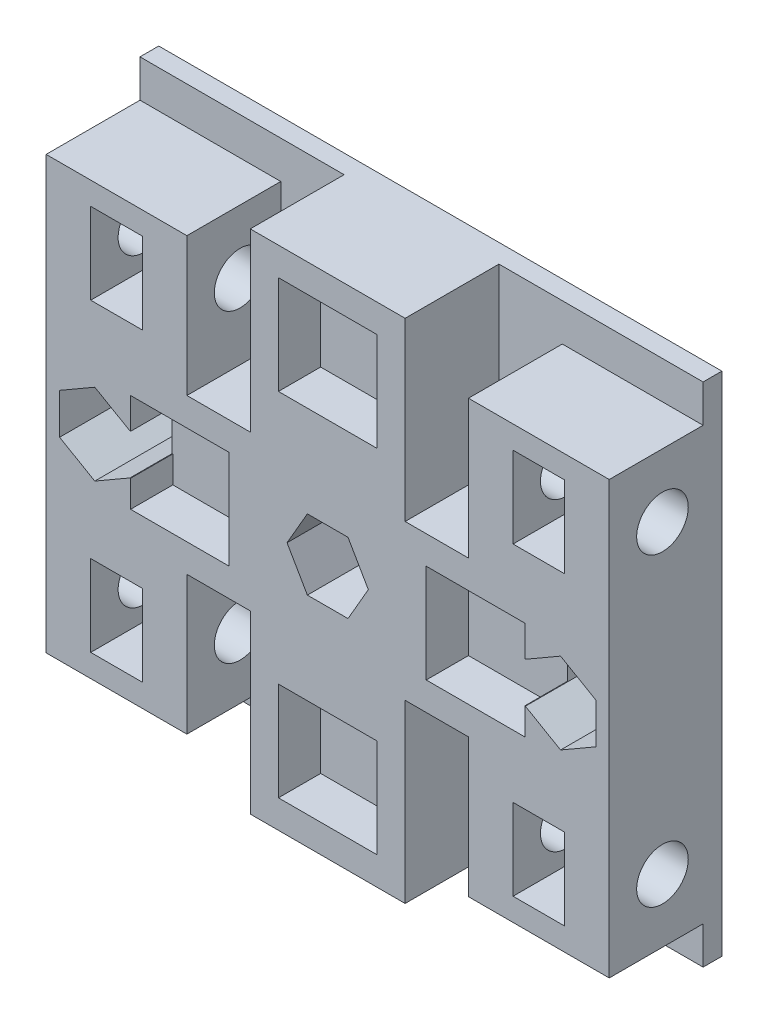
from build123d import *

# Parameters (mm, degrees)
ESQUISSE1_W               = 60
ESQUISSE1_H               = 54
ESQUISSE1_R               = 2
BOSS_EXTRU_1_DEPTH        = 2
ESQUISSE2_W               = 15
ESQUISSE2_H               = 13.5
BOSS_EXTRU_2_DEPTH        = 10
ENL_V_MAT_EXTRU_2_DEPTH   = 16
ESQUISSE5_W               = 4.75
ESQUISSE5_H               = 13.5
BOSS_EXTRU_3_DEPTH        = 12
ESQUISSE6_W               = 5.5
ESQUISSE6_H               = 8.66
ENL_V_MAT_EXTRU_3_DEPTH   = 6.25
ESQUISSE7_R               = 2.75
ENL_V_MAT_EXTRU_4_DEPTH   = 28
SYM_TRIE2_COPY_1_SKETCH_W = 15
SYM_TRIE2_COPY_1_SKETCH_H = 13.5
SYM_TRIE2_COPY_1_DEPTH    = 10
SYM_TRIE2_COPY_2_DEPTH    = 16
SYM_TRIE2_COPY_3_SKETCH_W = 4.75
SYM_TRIE2_COPY_3_SKETCH_H = 13.5
SYM_TRIE2_COPY_3_DEPTH    = 12
SYM_TRIE2_COPY_4_SKETCH_W = 5.5
SYM_TRIE2_COPY_4_SKETCH_H = 8.66
SYM_TRIE2_COPY_4_DEPTH    = 6.25
SYM_TRIE2_COPY_5_SKETCH_R = 2.75
SYM_TRIE2_COPY_5_DEPTH    = 28
ESQUISSE8_W               = 10.5
ESQUISSE8_H               = 3
BOSS_EXTRU_4_DEPTH        = 10
ESQUISSE12_W              = 15
ESQUISSE12_H              = 19
BOSS_EXTRU_6_DEPTH        = 10
ESQUISSE9_W               = 16.5
ESQUISSE9_H               = 16.5
ESQUISSE9_W_2             = 10.5
ESQUISSE9_H_2             = 10.5
BOSS_EXTRU_7_DEPTH        = 10
ENL_V_MAT_EXTRU_6_DEPTH   = 21
ESQUISSE13_W              = 10.5
ESQUISSE13_H              = 10.5
ENL_V_MAT_EXTRU_7_DEPTH   = 21
ESQUISSE15_R              = 2
ESQUISSE15_W              = 0.75
ESQUISSE15_H              = 2.25
BOSS_EXTRU_9_DEPTH        = 10
ENL_V_MAT_EXTRU_8_DEPTH   = 10
ESQUISSE17_W              = 10.5
ESQUISSE17_H              = 10.5
BOSS_EXTRU_10_DEPTH       = 5.5
ESQUISSE18_W              = 4.5
ESQUISSE18_H              = 4.330127019
ENL_V_MAT_EXTRU_9_DEPTH   = 1.5


with BuildPart() as part:
    # Esquisse1 → Boss.-Extru.1 (new body)
    with BuildSketch(Plane.XY):
        with Locations((30, -27)):
            Rectangle(ESQUISSE1_W, ESQUISSE1_H)
        with Locations((5, -27)):
            Circle(ESQUISSE1_R, mode=Mode.SUBTRACT)
        with Locations((30, -27)):
            Circle(ESQUISSE1_R, mode=Mode.SUBTRACT)
        with Locations((55, -27)):
            Circle(ESQUISSE1_R, mode=Mode.SUBTRACT)
    extrude(amount=BOSS_EXTRU_1_DEPTH)

    # Esquisse2 → Boss.-Extru.2 (add)
    with BuildSketch(Plane.XY.offset(2)):
        with Locations((7.5, -43.25)):
            Rectangle(ESQUISSE2_W, ESQUISSE2_H)
    boss_extru_2 = extrude(amount=BOSS_EXTRU_2_DEPTH)

    # Esquisse4 → Enlèv. mat.-Extru.2 (cut)
    with BuildSketch(Plane.ZY):
        Polygon((9.5, -45.415063509), (9.5, -41.084936491), (5.75, -38.919872981), (2, -41.084936491), (2, -45.415063509), (5.75, -47.580127019), align=None)
    enl_v_mat_extru_2 = extrude(amount=-ENL_V_MAT_EXTRU_2_DEPTH, mode=Mode.SUBTRACT)

    # Esquisse5 → Boss.-Extru.3 (add)
    with BuildSketch(Plane.XY.offset(12)):
        with Locations((2.375, -43.25)):
            Rectangle(ESQUISSE5_W, ESQUISSE5_H)
        with Locations((12.625, -43.25)):
            Rectangle(ESQUISSE5_W, ESQUISSE5_H)
    boss_extru_3 = extrude(amount=-BOSS_EXTRU_3_DEPTH)

    # Esquisse6 → Enlèv. mat.-Extru.3 (cut)
    with BuildSketch(Plane.XY.offset(12)):
        with Locations((7.5, -43.25)):
            Rectangle(ESQUISSE6_W, ESQUISSE6_H)
    enl_v_mat_extru_3 = extrude(amount=-ENL_V_MAT_EXTRU_3_DEPTH, mode=Mode.SUBTRACT)

    # Esquisse7 → Enlèv. mat.-Extru.4 (cut)
    with BuildSketch(Plane.ZY):
        with Locations((6.33, -43.25)):
            Circle(ESQUISSE7_R)
    enl_v_mat_extru_4 = extrude(amount=-ENL_V_MAT_EXTRU_4_DEPTH, mode=Mode.SUBTRACT)

    # Symétrie1: Boss.-Extru.2, Enlèv. mat.-Extru.2, Boss.-Extru.3, Enlèv. mat.-Extru.3, Enlèv. mat.-Extru.4 across plane
    add(boss_extru_2.mirror(Plane(origin=(0, -27, 0), x_dir=(0, 0, 1), z_dir=(0, -1, 0))))
    add(enl_v_mat_extru_2.mirror(Plane(origin=(0, -27, 0), x_dir=(0, 0, 1), z_dir=(0, -1, 0))), mode=Mode.SUBTRACT)
    add(boss_extru_3.mirror(Plane(origin=(0, -27, 0), x_dir=(0, 0, 1), z_dir=(0, -1, 0))))
    add(enl_v_mat_extru_3.mirror(Plane(origin=(0, -27, 0), x_dir=(0, 0, 1), z_dir=(0, -1, 0))), mode=Mode.SUBTRACT)
    add(enl_v_mat_extru_4.mirror(Plane(origin=(0, -27, 0), x_dir=(0, 0, 1), z_dir=(0, -1, 0))), mode=Mode.SUBTRACT)

    # Symétrie2: Boss.-Extru.2, Enlèv. mat.-Extru.2, Boss.-Extru.3, Enlèv. mat.-Extru.3, Enlèv. mat.-Extru.4 across plane
    add(boss_extru_2.mirror(Plane.ZY.offset(-30)))
    add(enl_v_mat_extru_2.mirror(Plane.ZY.offset(-30)), mode=Mode.SUBTRACT)
    add(boss_extru_3.mirror(Plane.ZY.offset(-30)))
    add(enl_v_mat_extru_3.mirror(Plane.ZY.offset(-30)), mode=Mode.SUBTRACT)
    add(enl_v_mat_extru_4.mirror(Plane.ZY.offset(-30)), mode=Mode.SUBTRACT)

    # Symétrie2 copy 1 sketch → Symétrie2 copy 1 (add)
    with BuildSketch(Plane(origin=(60, -54, 2), x_dir=(-1, 0, 0), z_dir=(0, 0, 1))):
        with Locations((7.5, -43.25)):
            Rectangle(SYM_TRIE2_COPY_1_SKETCH_W, SYM_TRIE2_COPY_1_SKETCH_H)
    extrude(amount=SYM_TRIE2_COPY_1_DEPTH)

    # Symétrie2 copy 2 sketch → Symétrie2 copy 2 (cut)
    with BuildSketch(Plane(origin=(60, -54, 0), x_dir=(0, 0, 1), z_dir=(1, 0, 0))):
        Polygon((9.5, -45.415063509), (9.5, -41.084936491), (5.75, -38.919872981), (2, -41.084936491), (2, -45.415063509), (5.75, -47.580127019), align=None)
    extrude(amount=-SYM_TRIE2_COPY_2_DEPTH, mode=Mode.SUBTRACT)

    # Symétrie2 copy 3 sketch → Symétrie2 copy 3 (add)
    with BuildSketch(Plane(origin=(60, -54, 12), x_dir=(-1, 0, 0), z_dir=(0, 0, 1))):
        with Locations((2.375, -43.25)):
            Rectangle(SYM_TRIE2_COPY_3_SKETCH_W, SYM_TRIE2_COPY_3_SKETCH_H)
        with Locations((12.625, -43.25)):
            Rectangle(SYM_TRIE2_COPY_3_SKETCH_W, SYM_TRIE2_COPY_3_SKETCH_H)
    extrude(amount=-SYM_TRIE2_COPY_3_DEPTH)

    # Symétrie2 copy 4 sketch → Symétrie2 copy 4 (cut)
    with BuildSketch(Plane(origin=(60, -54, 12), x_dir=(-1, 0, 0), z_dir=(0, 0, 1))):
        with Locations((7.5, -43.25)):
            Rectangle(SYM_TRIE2_COPY_4_SKETCH_W, SYM_TRIE2_COPY_4_SKETCH_H)
    extrude(amount=-SYM_TRIE2_COPY_4_DEPTH, mode=Mode.SUBTRACT)

    # Symétrie2 copy 5 sketch → Symétrie2 copy 5 (cut)
    with BuildSketch(Plane(origin=(60, -54, 0), x_dir=(0, 0, 1), z_dir=(1, 0, 0))):
        with Locations((6.33, -43.25)):
            Circle(SYM_TRIE2_COPY_5_SKETCH_R)
    extrude(amount=-SYM_TRIE2_COPY_5_DEPTH, mode=Mode.SUBTRACT)

    # Esquisse8 → Boss.-Extru.4 (add)
    with BuildSketch(Plane.XY.offset(2)):
        Polygon((35.25, -51), (35.25, -54), (38.25, -54), (38.25, -37.5), (21.75, -37.5), (21.75, -54), (24.75, -54), (24.75, -51), (24.75, -40.5), (35.25, -40.5), align=None)
        with Locations((30, -52.5)):
            Rectangle(ESQUISSE8_W, ESQUISSE8_H)
    boss_extru_4 = extrude(amount=BOSS_EXTRU_4_DEPTH)

    # Esquisse12 → Boss.-Extru.6 (add)
    with BuildSketch(Plane.XY.offset(2)):
        with Locations((7.5, -27)):
            Rectangle(ESQUISSE12_W, ESQUISSE12_H)
    boss_extru_6 = extrude(amount=BOSS_EXTRU_6_DEPTH)

    # Esquisse9 → Boss.-Extru.7 (add)
    with BuildSketch(Plane.XY.offset(2)):
        with Locations((14.25, -27)):
            Rectangle(ESQUISSE9_W, ESQUISSE9_H)
        with Locations((14.25, -27)):
            Rectangle(ESQUISSE9_W_2, ESQUISSE9_H_2, mode=Mode.SUBTRACT)
    boss_extru_7 = extrude(amount=BOSS_EXTRU_7_DEPTH)

    # Esquisse11 → Enlèv. mat.-Extru.6 (cut)
    with BuildSketch(Plane.XY.offset(2)):
        Polygon((8.935840957, -29.386947115), (8.935840957, -25.056820096), (5.185840957, -22.891756586), (1.435840957, -25.056820096), (1.435840957, -29.386947115), (5.185840957, -31.552010624), align=None)
    enl_v_mat_extru_6 = extrude(amount=ENL_V_MAT_EXTRU_6_DEPTH, mode=Mode.SUBTRACT)

    # Esquisse13 → Enlèv. mat.-Extru.7 (cut)
    with BuildSketch(Plane.XY.offset(2)):
        with Locations((14.25, -27)):
            Rectangle(ESQUISSE13_W, ESQUISSE13_H)
    enl_v_mat_extru_7 = extrude(amount=ENL_V_MAT_EXTRU_7_DEPTH, mode=Mode.SUBTRACT)

    # Symétrie3: Boss.-Extru.6, Boss.-Extru.7, Enlèv. mat.-Extru.6, Enlèv. mat.-Extru.7 across plane
    add(boss_extru_6.mirror(Plane.ZY.offset(-30)))
    add(boss_extru_7.mirror(Plane.ZY.offset(-30)))
    add(enl_v_mat_extru_6.mirror(Plane.ZY.offset(-30)), mode=Mode.SUBTRACT)
    add(enl_v_mat_extru_7.mirror(Plane.ZY.offset(-30)), mode=Mode.SUBTRACT)

    # Symétrie4: Boss.-Extru.4 across plane
    add(boss_extru_4.mirror(Plane(origin=(0, -27, 0), x_dir=(0, 0, 1), z_dir=(0, -1, 0))))

    # Esquisse15 → Boss.-Extru.9 (add)
    # profile 1 of 5: a face of its own
    with BuildSketch(Plane.XY.offset(2)):
        Polygon((22.5, -35.25), (22.5, -37.5), (37.5, -37.5), (37.5, -35.25), (37.5, -18.75), (37.5, -16.5), (22.5, -16.5), (22.5, -18.75), align=None)
        with Locations((30, -27)):
            Circle(ESQUISSE15_R, mode=Mode.SUBTRACT)
    # profile 2 of 5: a face of its own
    with BuildSketch(Plane.XY.offset(2)):
        with Locations((22.125, -36.375)):
            Rectangle(ESQUISSE15_W, ESQUISSE15_H)
    # profile 3 of 5: a face of its own
    with BuildSketch(Plane.XY.offset(2)):
        with Locations((37.875, -36.375)):
            Rectangle(ESQUISSE15_W, ESQUISSE15_H)
    # profile 4 of 5: a face of its own
    with BuildSketch(Plane.XY.offset(2)):
        with Locations((37.875, -17.625)):
            Rectangle(ESQUISSE15_W, ESQUISSE15_H)
    # profile 5 of 5: a face of its own
    with BuildSketch(Plane.XY.offset(2)):
        with Locations((22.125, -17.625)):
            Rectangle(ESQUISSE15_W, ESQUISSE15_H)
    extrude(amount=BOSS_EXTRU_9_DEPTH)

    # Esquisse16 → Enlèv. mat.-Extru.8 (cut)
    with BuildSketch(Plane.XY.offset(12)):
        Polygon((32.165063509, -23.25), (27.834936491, -23.25), (25.669872981, -27), (27.834936491, -30.75), (32.165063509, -30.75), (34.330127019, -27), align=None)
    extrude(amount=-ENL_V_MAT_EXTRU_8_DEPTH, mode=Mode.SUBTRACT)

    # Esquisse17 → Boss.-Extru.10 (add)
    with BuildSketch(Plane.XY.offset(2)):
        with Locations((14.25, -27)):
            Rectangle(ESQUISSE17_W, ESQUISSE17_H)
        with Locations((45.75, -27)):
            Rectangle(ESQUISSE17_W, ESQUISSE17_H)
        with Locations((30, -8.25)):
            Rectangle(ESQUISSE17_W, ESQUISSE17_H)
        with Locations((30, -45.75)):
            Rectangle(ESQUISSE17_W, ESQUISSE17_H)
    extrude(amount=BOSS_EXTRU_10_DEPTH)

    # Esquisse18 → Enlèv. mat.-Extru.9 (cut)
    with BuildSketch(Plane(origin=(9, 0, 0), x_dir=(0, 0, -1), z_dir=(1, 0, 0))):
        with Locations((-9.75, -27.221883606)):
            Rectangle(ESQUISSE18_W, ESQUISSE18_H)
    enl_v_mat_extru_9 = extrude(amount=-ENL_V_MAT_EXTRU_9_DEPTH, mode=Mode.SUBTRACT)

    # Symétrie5: Enlèv. mat.-Extru.9 across plane
    add(enl_v_mat_extru_9.mirror(Plane.ZY.offset(-30)), mode=Mode.SUBTRACT)


solid = part.part
